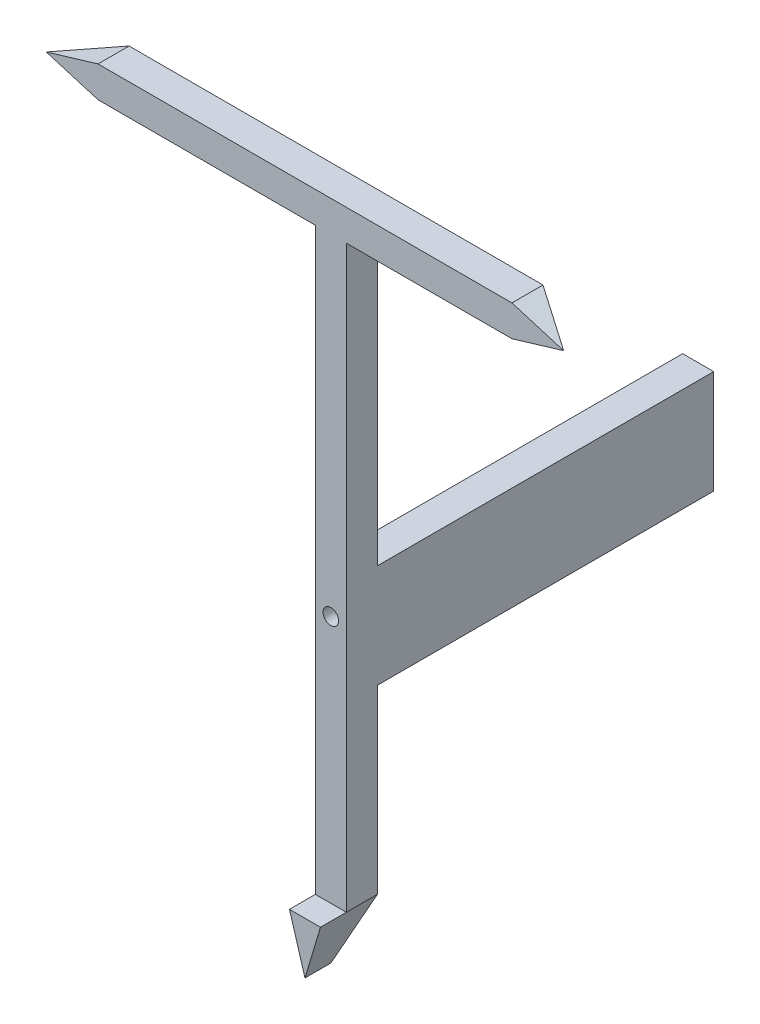
from build123d import *

# Parameters (mm, degrees)
SKETCH1_R               = 1.905
BOSS_EXTRUDE1_DEPTH     = 7.62
CUT_EXTRUDE1_DEPTH      = 175.688488459
CUT_EXTRUDE2_DEPTH      = 176.172550646
BOSS_EXTRUDE3_DEPTH     = 6.35
SKETCH7_W               = 82.55
SKETCH7_H               = 25.4
BOSS_EXTRUDE4_DEPTH     = 7.62
CUT_EXTRUDE3_DEPTH      = 190.863938124
CUT_EXTRUDE3_DEPTH_BACK = 190.863938124
SKETCH8_R               = 1.905


with BuildPart() as part:
    # Sketch1 → Boss-Extrude1 (new body)
    with BuildSketch(Plane.XY):
        Polygon((-63.5, 0), (-50.8, 3.81), (50.8, 3.81), (63.5, 0), (50.8, -3.81), (10.16, -3.81), (10.16, -146.05), (6.35, -158.75), (2.54, -146.05), (2.54, -3.81), (-50.8, -3.81), align=None)
        with Locations((6.35, -85.09)):
            Circle(SKETCH1_R, mode=Mode.SUBTRACT)
    extrude(amount=-BOSS_EXTRUDE1_DEPTH)

    # Sketch3 → Cut-Extrude1 (cut, through all)
    with BuildSketch(Plane(origin=(0, 3.81, 0), x_dir=(1, 0, 0), z_dir=(0, 1, 0))):
        Polygon((-63.5, 0), (-50.8, 7.62), (-63.5, 7.62), align=None)
        Polygon((63.5, 7.62), (63.5, 0), (50.8, 7.62), align=None)
    extrude(amount=-CUT_EXTRUDE1_DEPTH, mode=Mode.SUBTRACT)

    # Sketch4 → Cut-Extrude2 (cut, through all)
    with BuildSketch(Plane(origin=(10.16, 0, 0), x_dir=(0, 0, -1), z_dir=(1, 0, 0))):
        Polygon((0, -158.75), (7.62, -146.05), (7.62, -158.75), align=None)
    extrude(amount=-CUT_EXTRUDE2_DEPTH, mode=Mode.SUBTRACT)

    # Sketch6 → Boss-Extrude3 (add)
    with BuildSketch(Plane.XY):
        Polygon((2.54, -146.05), (10.16, -146.05), (6.35, -158.75), align=None)
    extrude(amount=BOSS_EXTRUDE3_DEPTH)

    # Sketch7 → Boss-Extrude4 (add)
    with BuildSketch(Plane.ZY.offset(-2.54)):
        with Locations((-48.895, -88.9)):
            Rectangle(SKETCH7_W, SKETCH7_H)
    extrude(amount=-BOSS_EXTRUDE4_DEPTH)

    # Sketch8 → Cut-Extrude3 (cut, two sides: drawn at the far end of the back side and taken through both)
    with BuildSketch(Plane.XY.offset(-7.62).offset(-CUT_EXTRUDE3_DEPTH_BACK)):
        with Locations((6.35, -85.09)):
            Circle(SKETCH8_R)
    extrude(amount=CUT_EXTRUDE3_DEPTH + CUT_EXTRUDE3_DEPTH_BACK, mode=Mode.SUBTRACT)


solid = part.part
